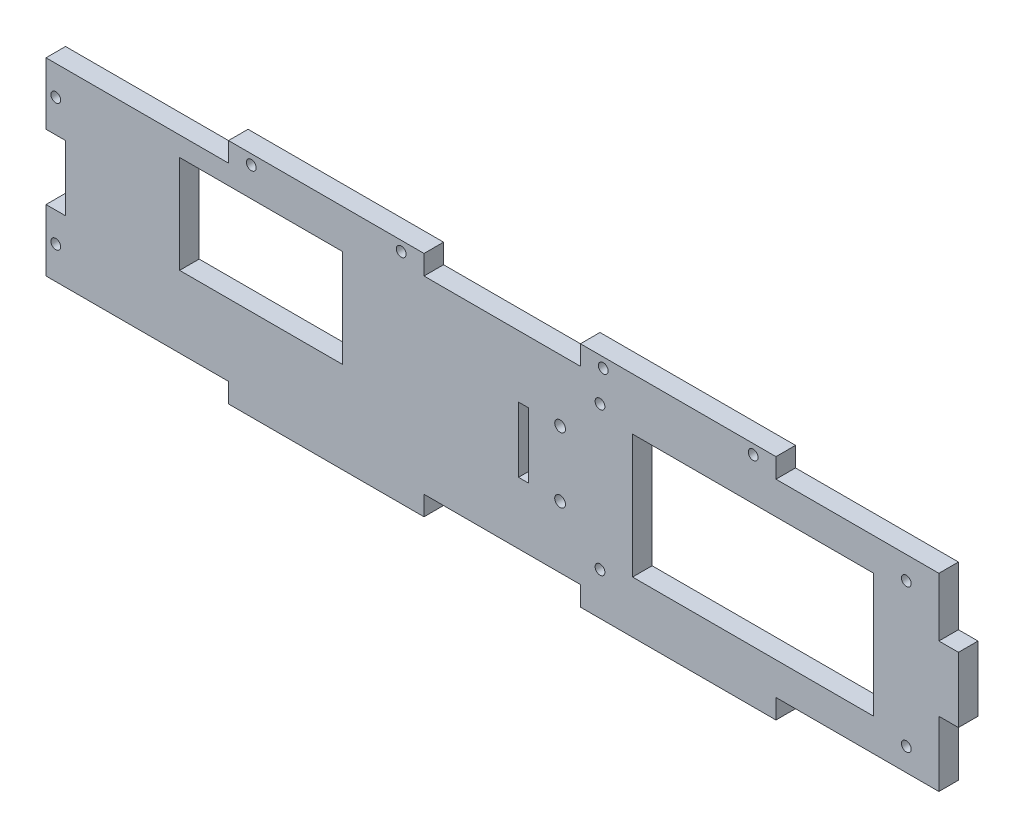
from build123d import *

# Parameters (mm, degrees)
ESQUISSE1_W             = 268
ESQUISSE1_H             = 70
BOSS_EXTRU_1_DEPTH      = 6
ESQUISSE2_W             = 50
ESQUISSE2_H             = 6
ESQUISSE2_W_2           = 48
ENL_V_MAT_EXTRU_1_DEPTH = 278.055951028
ESQUISSE3_W             = 6
ESQUISSE3_H             = 20
BOSS_EXTRU_2_DEPTH      = 6
ESQUISSE4_R             = 1.5
ESQUISSE4_W             = 74
ESQUISSE4_H             = 38
ESQUISSE4_W_2           = 3
ESQUISSE4_H_2           = 20
ESQUISSE4_W_3           = 50
ESQUISSE4_H_3           = 30
ENL_V_MAT_EXTRU_2_DEPTH = 10
ESQUISSE5_W             = 6
ESQUISSE5_H             = 19
BOSS_EXTRU_3_DEPTH      = 6
ESQUISSE6_R             = 1.5
ENL_V_MAT_EXTRU_3_DEPTH = 283.863924883
ESQUISSE7_R             = 2.995
ESQUISSE7_R_2           = 3
ENL_V_MAT_EXTRU_4_DEPTH = 3
ESQUISSE8_R             = 1.65
ENL_V_MAT_EXTRU_5_DEPTH = 283.863924883


with BuildPart() as part:
    # Esquisse1 → Boss.-Extru.1 (new body)
    with BuildSketch(Plane.XY):
        with Locations((-134, 35)):
            Rectangle(ESQUISSE1_W, ESQUISSE1_H)
    extrude(amount=BOSS_EXTRU_1_DEPTH)

    # Esquisse2 → Enlèv. mat.-Extru.1 (cut, through all)
    with BuildSketch(Plane.XY.offset(6)):
        with Locations((-243, 3)):
            Rectangle(ESQUISSE2_W, ESQUISSE2_H)
        with Locations((-25, 3)):
            Rectangle(ESQUISSE2_W, ESQUISSE2_H)
        with Locations((-134, 3)):
            Rectangle(ESQUISSE2_W_2, ESQUISSE2_H)
        with Locations((-243, 67)):
            Rectangle(ESQUISSE2_W, ESQUISSE2_H)
        with Locations((-134, 67)):
            Rectangle(ESQUISSE2_W_2, ESQUISSE2_H)
        with Locations((-25, 67)):
            Rectangle(ESQUISSE2_W, ESQUISSE2_H)
    extrude(amount=-ENL_V_MAT_EXTRU_1_DEPTH, mode=Mode.SUBTRACT)

    # Esquisse3 → Boss.-Extru.2 (add)
    with BuildSketch(Plane(origin=(0, 0, 0), x_dir=(0, 0, -1), z_dir=(1, 0, 0))):
        with Locations((-3, 36)):
            Rectangle(ESQUISSE3_W, ESQUISSE3_H)
    extrude(amount=BOSS_EXTRU_2_DEPTH)

    # Esquisse4 → Enlèv. mat.-Extru.2 (cut)
    with BuildSketch(Plane.XY.offset(6)):
        with Locations((-104, 57)):
            Circle(ESQUISSE4_R)
        with Locations((-104, 13)):
            Circle(ESQUISSE4_R)
        with Locations((-10, 57)):
            Circle(ESQUISSE4_R)
        with Locations((-10, 13)):
            Circle(ESQUISSE4_R)
        with Locations((-57, 35)):
            Rectangle(ESQUISSE4_W, ESQUISSE4_H)
        with Locations((-127.5, 35)):
            Rectangle(ESQUISSE4_W_2, ESQUISSE4_H_2)
        with Locations((-208, 43)):
            Rectangle(ESQUISSE4_W_3, ESQUISSE4_H_3)
    extrude(amount=-ENL_V_MAT_EXTRU_2_DEPTH, mode=Mode.SUBTRACT)

    # Esquisse5 → Boss.-Extru.3 (add)
    with BuildSketch(Plane.ZY.offset(268)):
        with Locations((3, 54.5)):
            Rectangle(ESQUISSE5_W, ESQUISSE5_H)
        with Locations((3, 15.5)):
            Rectangle(ESQUISSE5_W, ESQUISSE5_H)
    extrude(amount=BOSS_EXTRU_3_DEPTH)

    # Esquisse6 → Enlèv. mat.-Extru.3 (cut, through all)
    with BuildSketch(Plane(origin=(0, 0, 0), x_dir=(-1, 0, 0), z_dir=(0, 0, -1))):
        with Locations((271, 16)):
            Circle(ESQUISSE6_R)
        with Locations((271, 55)):
            Circle(ESQUISSE6_R)
        with Locations((211, 67)):
            Circle(ESQUISSE6_R)
        with Locations((165, 67)):
            Circle(ESQUISSE6_R)
        with Locations((103, 67)):
            Circle(ESQUISSE6_R)
        with Locations((57, 67)):
            Circle(ESQUISSE6_R)
    extrude(amount=-ENL_V_MAT_EXTRU_3_DEPTH, mode=Mode.SUBTRACT)

    # Esquisse7 → Enlèv. mat.-Extru.4 (cut)
    with BuildSketch(Plane(origin=(0, 0, 0), x_dir=(-1, 0, 0), z_dir=(0, 0, -1))):
        with Locations((271, 16)):
            Circle(ESQUISSE7_R)
        with Locations((271, 55)):
            Circle(ESQUISSE7_R)
        with Locations((211, 67)):
            Circle(ESQUISSE7_R)
        with Locations((165, 67)):
            Circle(ESQUISSE7_R)
        with Locations((103, 67)):
            Circle(ESQUISSE7_R)
        with Locations((57, 67)):
            Circle(ESQUISSE7_R)
        with Locations((104, 57)):
            Circle(ESQUISSE7_R_2)
        with Locations((104, 13)):
            Circle(ESQUISSE7_R_2)
        with Locations((10, 13)):
            Circle(ESQUISSE7_R_2)
        with Locations((10, 57)):
            Circle(ESQUISSE7_R_2)
    extrude(amount=-ENL_V_MAT_EXTRU_4_DEPTH, mode=Mode.SUBTRACT)

    # Esquisse8 → Enlèv. mat.-Extru.5 (cut, through all)
    with BuildSketch(Plane(origin=(0, 0, 0), x_dir=(-1, 0, 0), z_dir=(0, 0, -1))):
        with Locations((116.242255389, 25)):
            Circle(ESQUISSE8_R)
        with Locations((116.242255389, 45)):
            Circle(ESQUISSE8_R)
    extrude(amount=-ENL_V_MAT_EXTRU_5_DEPTH, mode=Mode.SUBTRACT)


solid = part.part
